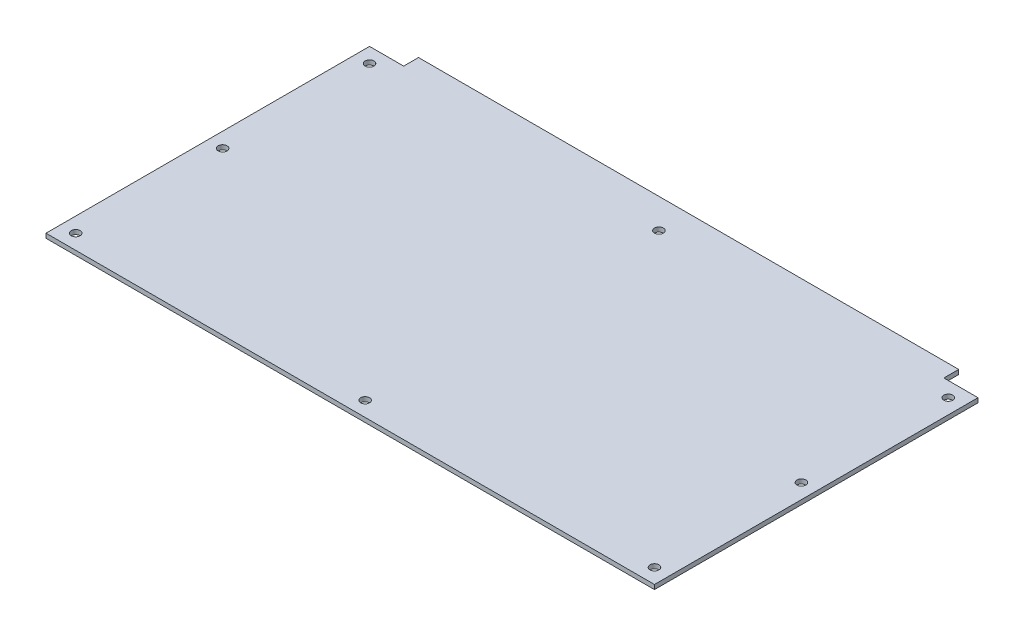
from build123d import *

# Parameters (mm, degrees)
CROQUIS1_R              = 3
SALIENTE_EXTRUIR1_DEPTH = 3


with BuildPart() as part:
    # Croquis1 → Saliente-Extruir1 (new body)
    with BuildSketch(Plane(origin=(0, 0, 0), x_dir=(1, 0, 0), z_dir=(0, 1, 0))):
        Polygon((-182, 109), (-182, 119), (182, 119), (182, 109), (205, 109), (205, -109), (-205, -109), (-205, 109), align=None)
        with Locations(Location((-195, -99, 0), (0, 0, 270))):
            Circle(CROQUIS1_R, mode=Mode.SUBTRACT)
        with Locations(Location((0, -99, 0), (0, 0, 270))):
            Circle(CROQUIS1_R, mode=Mode.SUBTRACT)
        with Locations(Location((-195, 0, 0), (0, 0, 270))):
            Circle(CROQUIS1_R, mode=Mode.SUBTRACT)
        with Locations(Location((-195, 99, 0), (0, 0, 90))):
            Circle(CROQUIS1_R, mode=Mode.SUBTRACT)
        with Locations(Location((195, 99, 0), (0, 0, 270))):
            Circle(CROQUIS1_R, mode=Mode.SUBTRACT)
        with Locations(Location((195, 0, 0), (0, 0, 90))):
            Circle(CROQUIS1_R, mode=Mode.SUBTRACT)
        with Locations(Location((195, -99, 0), (0, 0, 90))):
            Circle(CROQUIS1_R, mode=Mode.SUBTRACT)
        with Locations(Location((0, 99, 0), (0, 0, 90))):
            Circle(CROQUIS1_R, mode=Mode.SUBTRACT)
    extrude(amount=SALIENTE_EXTRUIR1_DEPTH)


solid = part.part
